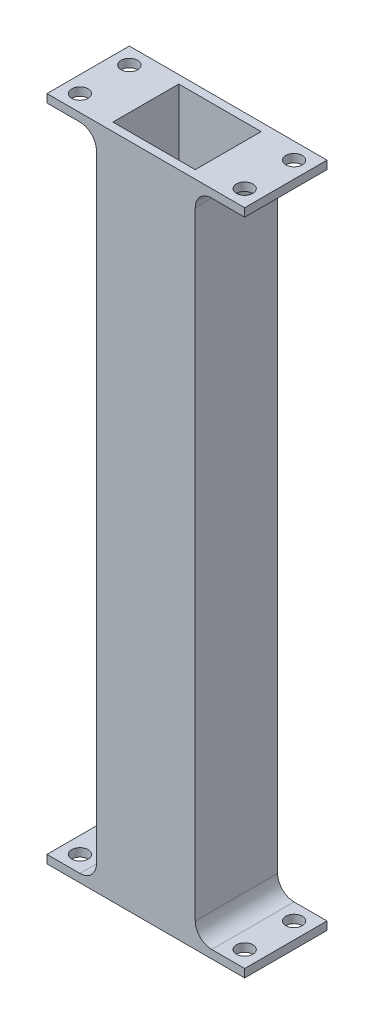
from build123d import *

# Parameters (mm, degrees)
SKETCH1_W            = 60
SKETCH1_H            = 50
BOSS_EXTRUDE1_DEPTH  = 200
SKETCH2_W            = 120
SKETCH2_H            = 50
BOSS_EXTRUDE2_DEPTH  = 2.5
FILLET1_R            = 10
SKETCH3_R            = 5
CUT_EXTRUDE1_DEPTH   = 403.779406127
FILLET1_OF_MIRROR1_R = 10
SKETCH4_W            = 50
SKETCH4_H            = 40
CUT_EXTRUDE2_DEPTH   = 411.18288604


with BuildPart() as part:
    # Sketch1 → Boss-Extrude1 (new, symmetric)
    with BuildSketch(Plane(origin=(0, 0, 0), x_dir=(-1, 0, 0), z_dir=(0, 1, 0))):
        Rectangle(SKETCH1_W, SKETCH1_H)
    extrude(amount=BOSS_EXTRUDE1_DEPTH, both=True)

    # Sketch2 → Boss-Extrude2 (add, symmetric)
    with BuildSketch(Plane(origin=(0, 200, 0), x_dir=(-1, 0, 0), z_dir=(0, 1, 0))):
        Rectangle(SKETCH2_W, SKETCH2_H)
    boss_extrude2 = extrude(amount=BOSS_EXTRUDE2_DEPTH, both=True)

    # Fillet1
    fillet1_edges = [part.edges().sort_by_distance(p)[0] for p in [
        (-30, 197.5, 0),
        (30, 197.5, 0),
    ]]
    fillet(fillet1_edges, radius=FILLET1_R)

    # Sketch3 → Cut-Extrude1 (cut, through all)
    with BuildSketch(Plane.XZ.offset(-197.5)):
        with Locations(Location((50, 15, 0), (0, 0, 270))):
            Circle(SKETCH3_R)
        with Locations(Location((50, -15, 0), (0, 0, 90))):
            Circle(SKETCH3_R)
        with Locations(Location((-50, 15, 0), (0, 0, 90))):
            Circle(SKETCH3_R)
        with Locations(Location((-50, -15, 0), (0, 0, 270))):
            Circle(SKETCH3_R)
    cut_extrude1 = extrude(amount=-CUT_EXTRUDE1_DEPTH, mode=Mode.SUBTRACT)

    # Mirror1: Boss-Extrude2, Cut-Extrude1 across plane
    add(boss_extrude2.mirror(Plane.ZX))
    add(cut_extrude1.mirror(Plane.ZX), mode=Mode.SUBTRACT)

    # Fillet1 of Mirror1
    fillet1_of_mirror1_edges = [part.edges().sort_by_distance(p)[0] for p in [
        (-30, -197.5, 0),
        (30, -197.5, 0),
    ]]
    fillet(fillet1_of_mirror1_edges, radius=FILLET1_OF_MIRROR1_R)

    # Sketch4 → Cut-Extrude2 (cut, through all)
    with BuildSketch(Plane.XZ.offset(202.5)):
        Rectangle(SKETCH4_W, SKETCH4_H)
    extrude(amount=-CUT_EXTRUDE2_DEPTH, mode=Mode.SUBTRACT)


solid = part.part
